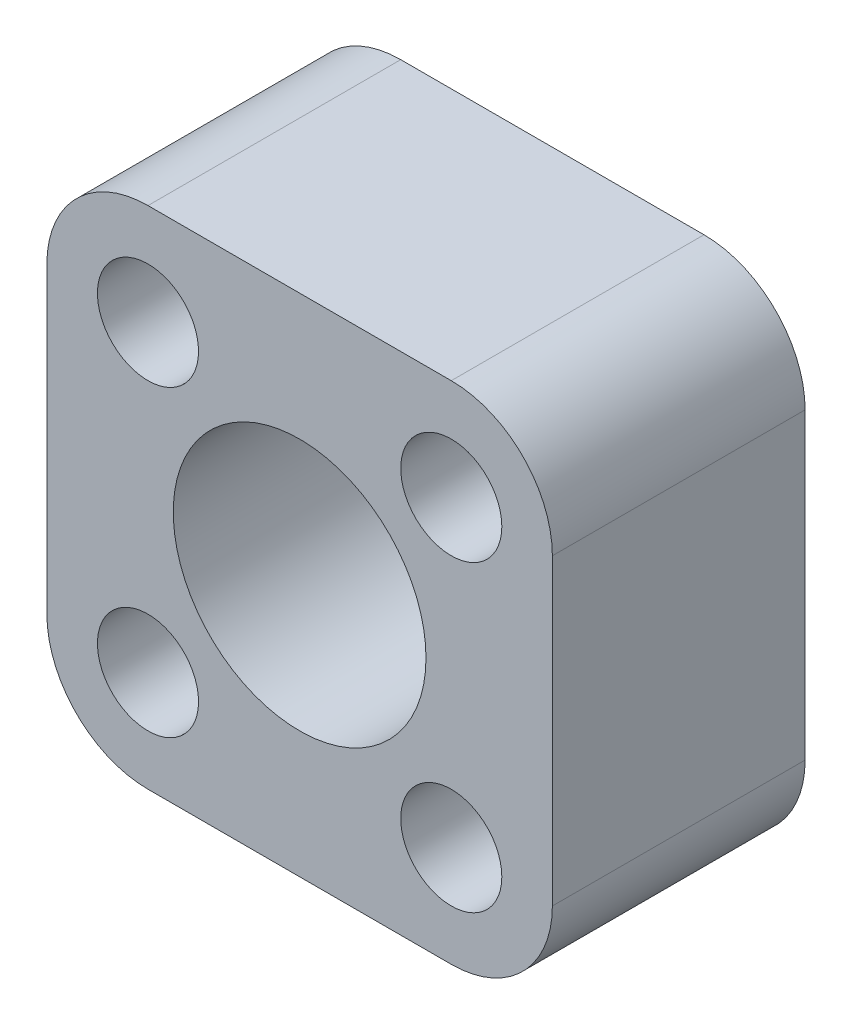
from build123d import *

# Parameters (mm, degrees)
ESQUISSE1_R        = 1
ESQUISSE1_R_2      = 2.5
BOSS_EXTRU_1_DEPTH = 5


with BuildPart() as part:
    # Esquisse1 → Boss.-Extru.1 (new body)
    with BuildSketch(Plane.XY):
        with BuildLine():
            Line((-3, 5), (3, 5))
            ThreePointArc((3, 5), (4.414213562, 4.414213562), (5, 3))
            Line((5, 3), (5, -3))
            ThreePointArc((5, -3), (4.414213562, -4.414213562), (3, -5))
            Line((3, -5), (-3, -5))
            ThreePointArc((-3, -5), (-4.414213562, -4.414213562), (-5, -3))
            Line((-5, -3), (-5, 3))
            ThreePointArc((-5, 3), (-4.414213562, 4.414213562), (-3, 5))
        make_face()
        with Locations((-3, 3)):
            Circle(ESQUISSE1_R, mode=Mode.SUBTRACT)
        with Locations((3, 3)):
            Circle(ESQUISSE1_R, mode=Mode.SUBTRACT)
        with Locations((3, -3)):
            Circle(ESQUISSE1_R, mode=Mode.SUBTRACT)
        with Locations((-3, -3)):
            Circle(ESQUISSE1_R, mode=Mode.SUBTRACT)
        Circle(ESQUISSE1_R_2, mode=Mode.SUBTRACT)
    extrude(amount=BOSS_EXTRU_1_DEPTH)


solid = part.part
